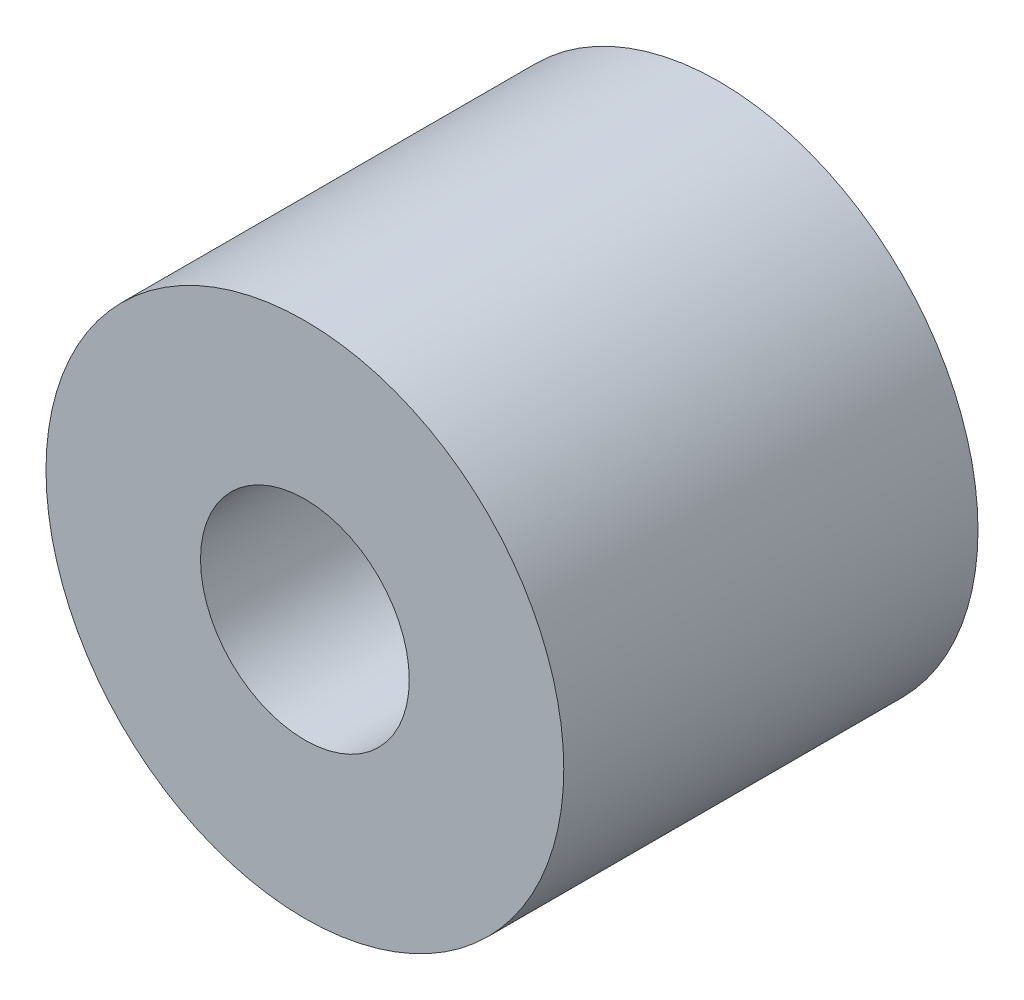
from build123d import *

# Parameters (mm, degrees)
SKETCH1_R      = 7.9375
SKETCH1_R_2    = 3.2004
EXTRUDE1_DEPTH = 6.35


with BuildPart() as part:
    # Sketch1 → Extrude1 (new, symmetric)
    with BuildSketch(Plane.XY):
        Circle(SKETCH1_R)
        Circle(SKETCH1_R_2, mode=Mode.SUBTRACT)
    extrude(amount=EXTRUDE1_DEPTH, both=True)


solid = part.part
